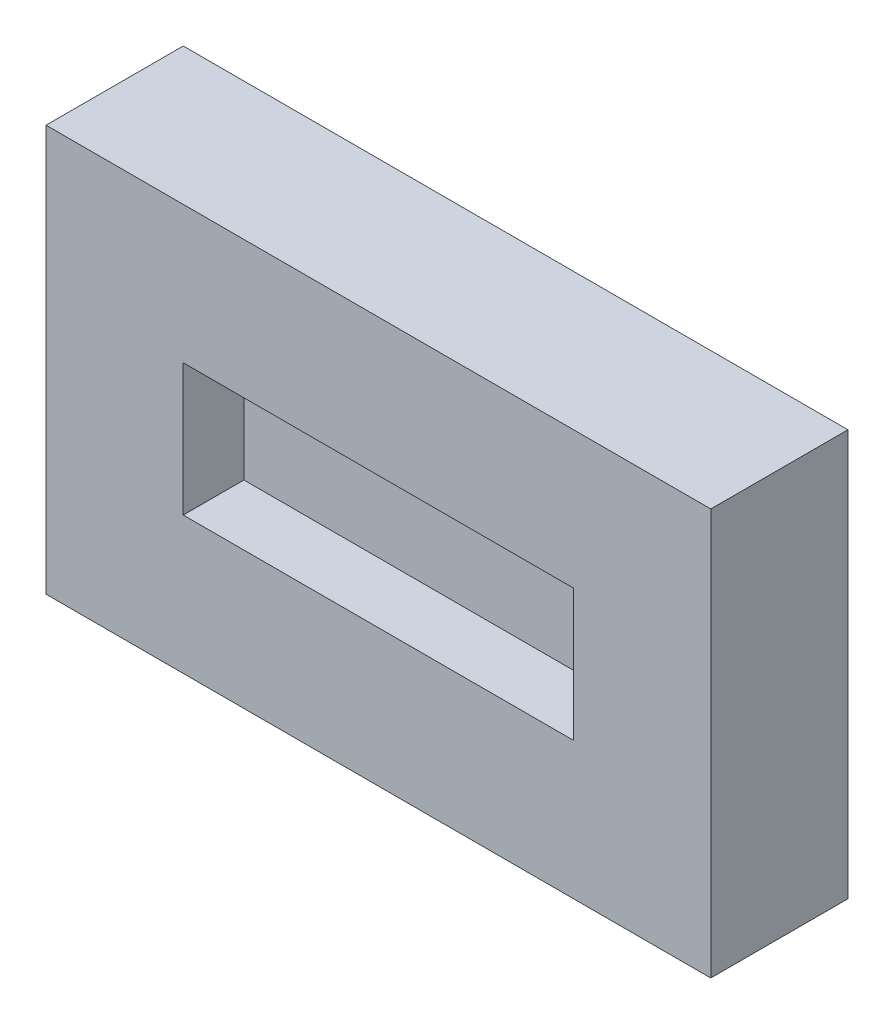
from build123d import *

# Parameters (mm, degrees)
RESSALTO_EXTRUS_O1_DEPTH      = 7.5
RESSALTO_EXTRUS_O1_DEPTH_BACK = 7.5
ESBO_O1_W                     = 370
ESBO_O1_H                     = 125
RESSALTO_EXTRUS_O3_DEPTH      = 65
RESSALTO_EXTRUS_O3_DEPTH_BACK = 65
ESBO_O3_W                     = 630
ESBO_O3_H                     = 385
ESBO_O3_W_2                   = 370
ESBO_O3_H_2                   = 125


with BuildPart() as part:
    # Esboço1 → Ressalto-extrusão1 (new, two sides: drawn at the far end of the back side and taken through both)
    with BuildSketch(Plane.XY.offset(-RESSALTO_EXTRUS_O1_DEPTH_BACK)):
        Rectangle(ESBO_O1_W, ESBO_O1_H)
    extrude(amount=RESSALTO_EXTRUS_O1_DEPTH + RESSALTO_EXTRUS_O1_DEPTH_BACK)


with BuildPart() as body_2:
    # Esboço3 → Ressalto-extrusão3 (new, two sides: drawn at the far end of the back side and taken through both)
    with BuildSketch(Plane.XY.offset(-RESSALTO_EXTRUS_O3_DEPTH_BACK)):
        Rectangle(ESBO_O3_W, ESBO_O3_H)
        Rectangle(ESBO_O3_W_2, ESBO_O3_H_2, mode=Mode.SUBTRACT)
    extrude(amount=RESSALTO_EXTRUS_O3_DEPTH + RESSALTO_EXTRUS_O3_DEPTH_BACK)


solid = Compound([part.part, body_2.part])
